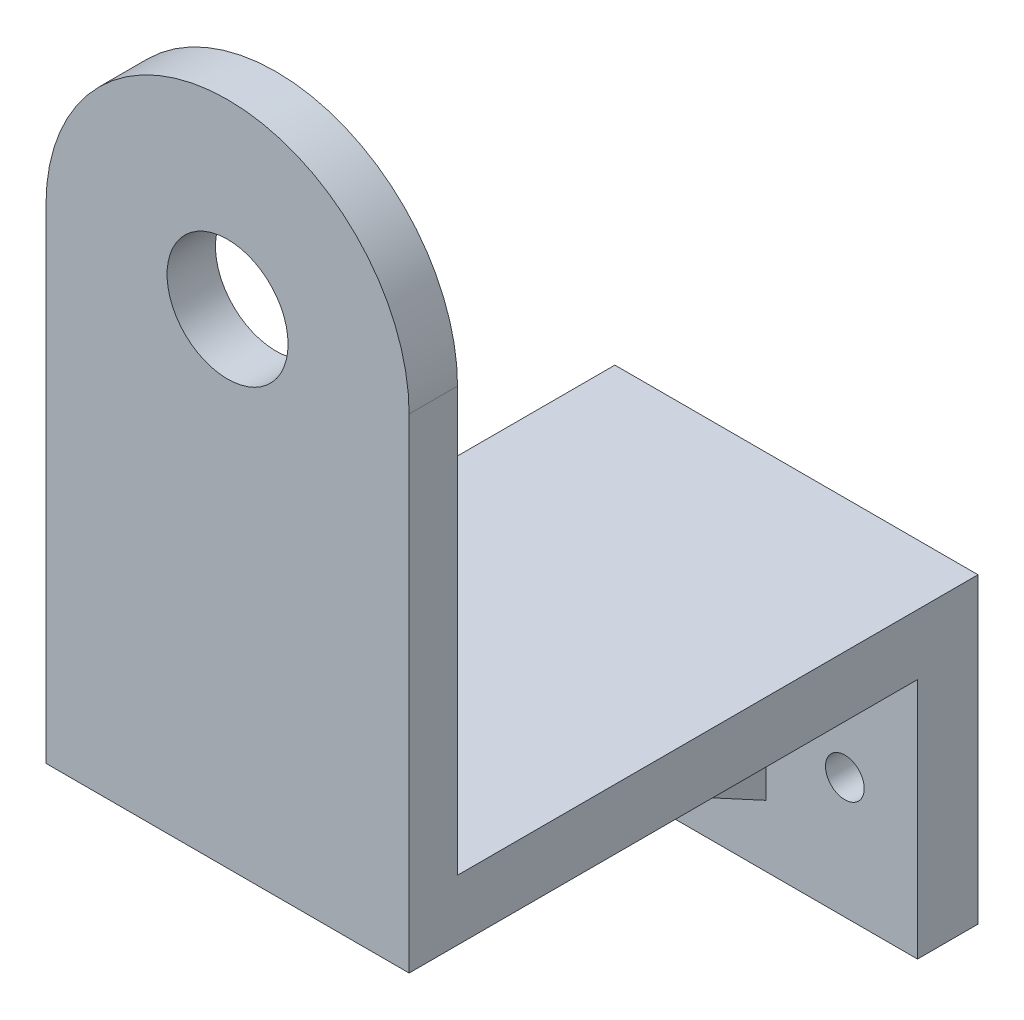
from build123d import *

# Parameters (mm, degrees)
SKETCH1_R           = 5
BOSS_EXTRUDE1_DEPTH = 4
SKETCH2_W           = 30
SKETCH2_H           = 38
BOSS_EXTRUDE2_DEPTH = 5
SKETCH4_W           = 30
SKETCH4_H           = 25
SKETCH4_R           = 1.6
BOSS_EXTRUDE3_DEPTH = 5
RIB1_REACH          = 77.326
SKETCH5_WALL_W      = 184.007294544
SKETCH5_WALL_H      = 5


with BuildPart() as part:
    # Sketch1 → Boss-Extrude1 (new body)
    with BuildSketch(Plane.XY):
        with BuildLine():
            Line((15, 0), (15, -40))
            Line((15, -40), (-15, -40))
            Line((-15, -40), (-15, 0))
            ThreePointArc((-15, 0), (0, 15), (15, 0))
        make_face()
        Circle(SKETCH1_R, mode=Mode.SUBTRACT)
    extrude(amount=BOSS_EXTRUDE1_DEPTH)

    # Sketch2 → Boss-Extrude2 (add)
    with BuildSketch(Plane.XZ.offset(40)):
        with Locations((0, -19)):
            Rectangle(SKETCH2_W, SKETCH2_H)
    extrude(amount=-BOSS_EXTRUDE2_DEPTH)

    # Sketch4 → Boss-Extrude3 (add)
    with BuildSketch(Plane(origin=(0, 0, -38), x_dir=(-1, 0, 0), z_dir=(0, 0, -1))):
        with Locations((0, -47.5)):
            Rectangle(SKETCH4_W, SKETCH4_H)
        with Locations((9, -50)):
            Circle(SKETCH4_R, mode=Mode.SUBTRACT)
        with Locations((-9, -50)):
            Circle(SKETCH4_R, mode=Mode.SUBTRACT)
    extrude(amount=BOSS_EXTRUDE3_DEPTH)

    # Sketch5 wall → Rib1 (add, up to next)
    with BuildSketch(Plane(origin=(0, -47.446002706, -24.203370922), x_dir=(0, 0.474942623165, 0.880016763875), z_dir=(0, -0.880016763875, 0.474942623165)), mode=Mode.PRIVATE) as rib1_sk1:
        Rectangle(SKETCH5_WALL_W, SKETCH5_WALL_H)
    rib1_tool1 = extrude(rib1_sk1.sketch, amount=-RIB1_REACH, mode=Mode.PRIVATE) - part.part
    add(rib1_tool1.solids().sort_by_distance((0, -47.446002706, -24.203370922))[0])


solid = part.part
